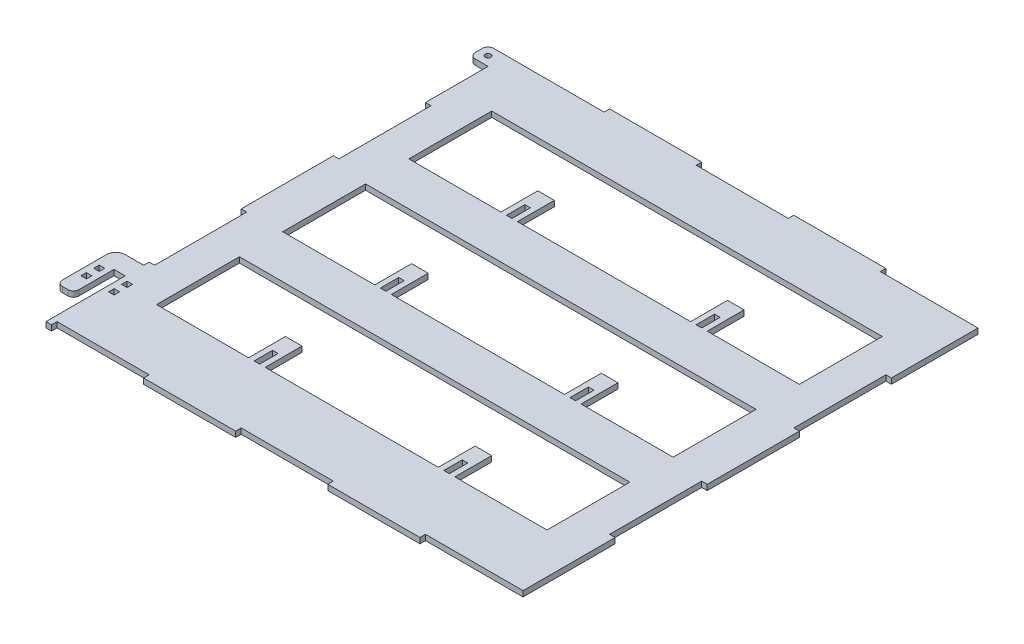
from build123d import *

# Parameters (mm, degrees)
SKETCH1_R           = 1.5
SKETCH1_W           = 3
SKETCH1_H           = 3
SKETCH1_H_2         = 10
BOSS_EXTRUDE1_DEPTH = 3


with BuildPart() as part:
    # Sketch1 → Boss-Extrude1 (new body)
    with BuildSketch(Plane(origin=(0, 0, 0), x_dir=(1, 0, 0), z_dir=(0, 1, 0))):
        with BuildLine():
            Line((256, 100), (256, 150))
            Line((256, 150), (253, 150))
            Line((253, 150), (253, 200))
            Line((253, 200), (256, 200))
            Line((256, 200), (256, 247))
            Line((256, 247), (203, 247))
            Line((203, 247), (203, 250))
            Line((203, 250), (153, 250))
            Line((153, 250), (153, 247))
            Line((153, 247), (103, 247))
            Line((103, 247), (103, 250))
            Line((103, 250), (53, 250))
            Line((53, 250), (53, 247))
            Line((53, 247), (-7, 247))
            ThreePointArc((-7, 247), (-9.121320344, 246.121320344), (-10, 244))
            Line((-10, 244), (-10, 240))
            ThreePointArc((-10, 240), (-9.121320344, 237.878679656), (-7, 237))
            Line((-7, 237), (0, 237))
            Line((0, 237), (0, 203))
            Line((0, 203), (3, 203))
            Line((3, 203), (3, 153))
            Line((3, 153), (0, 153))
            Line((0, 153), (0, 103))
            Line((0, 103), (3, 103))
            Line((3, 103), (3, 53))
            Line((3, 53), (0, 53))
            Line((0, 53), (0, 50))
            Line((0, 50), (-10.1, 50))
            ThreePointArc((-10.1, 50), (-13.635533906, 48.535533906), (-15.1, 45))
            Line((-15.1, 45), (-15.1, 43))
            Line((-15.1, 43), (-15.1, 21))
            ThreePointArc((-15.1, 21), (-14.221320344, 18.878679656), (-12.1, 18))
            Line((-12.1, 18), (-9.1, 18))
            ThreePointArc((-9.1, 18), (-6.978679656, 18.878679656), (-6.1, 21))
            Line((-6.1, 21), (-6.1, 40))
            Line((-6.1, 40), (0, 40))
            Line((0, 40), (0, 0))
            Line((0, 0), (0, -3))
            Line((0, -3), (3, -3))
            Line((3, -3), (3, 0))
            Line((3, 0), (53, 0))
            Line((53, 0), (53, -3))
            Line((53, -3), (103, -3))
            Line((103, -3), (103, 0))
            Line((103, 0), (153, 0))
            Line((153, 0), (153, -3))
            Line((153, -3), (203, -3))
            Line((203, -3), (203, 0))
            Line((203, 0), (256, 0))
            Line((256, 0), (256, 50))
            Line((256, 50), (253, 50))
            Line((253, 50), (253, 100))
            Line((253, 100), (256, 100))
        make_face()
        with Locations(Location((-5, 242, 0), (0, 0, 270))):
            Circle(SKETCH1_R, mode=Mode.SUBTRACT)
        with Locations((-10.6, 29.5)):
            Rectangle(SKETCH1_W, SKETCH1_H, mode=Mode.SUBTRACT)
        Polygon((184, 172), (234, 172), (234, 217), (22, 217), (22, 172), (72, 172), (72, 192), (81, 192), (81, 172), (175, 172), (175, 192), (184, 192), align=None, mode=Mode.SUBTRACT)
        with Locations((-10.6, 36.5)):
            Rectangle(SKETCH1_W, SKETCH1_H, mode=Mode.SUBTRACT)
        with Locations((4.5, 29.5)):
            Rectangle(SKETCH1_W, SKETCH1_H, mode=Mode.SUBTRACT)
        with Locations((4.5, 36.5)):
            Rectangle(SKETCH1_W, SKETCH1_H, mode=Mode.SUBTRACT)
        with Locations((76.5, 40)):
            Rectangle(SKETCH1_W, SKETCH1_H_2, mode=Mode.SUBTRACT)
        with Locations((179.5, 40)):
            Rectangle(SKETCH1_W, SKETCH1_H_2, mode=Mode.SUBTRACT)
        with Locations((76.5, 108.5)):
            Rectangle(SKETCH1_W, SKETCH1_H_2, mode=Mode.SUBTRACT)
        with Locations((179.5, 108.5)):
            Rectangle(SKETCH1_W, SKETCH1_H_2, mode=Mode.SUBTRACT)
        with Locations((76.5, 177)):
            Rectangle(SKETCH1_W, SKETCH1_H_2, mode=Mode.SUBTRACT)
        with Locations((179.5, 177)):
            Rectangle(SKETCH1_W, SKETCH1_H_2, mode=Mode.SUBTRACT)
        Polygon((22, 35), (72, 35), (72, 55), (81, 55), (81, 35), (175, 35), (175, 55), (184, 55), (184, 35), (234, 35), (234, 80), (22, 80), align=None, mode=Mode.SUBTRACT)
        Polygon((22, 103.5), (72, 103.5), (72, 123.5), (81, 123.5), (81, 103.5), (175, 103.5), (175, 123.5), (184, 123.5), (184, 103.5), (234, 103.5), (234, 148.5), (22, 148.5), align=None, mode=Mode.SUBTRACT)
    extrude(amount=BOSS_EXTRUDE1_DEPTH)


solid = part.part
